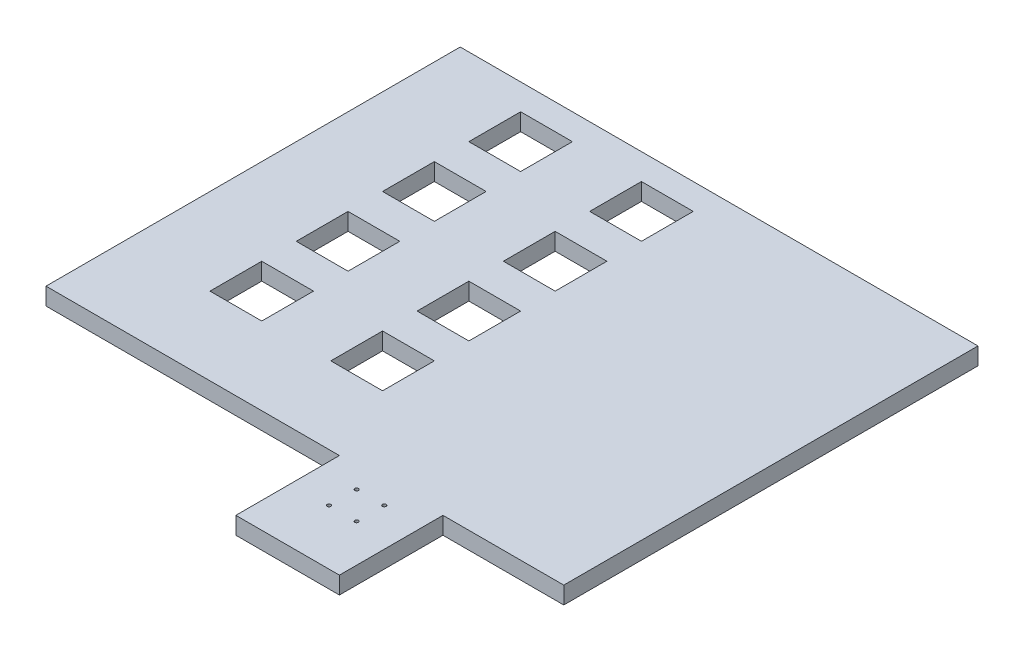
from build123d import *

# Parameters (mm, degrees)
EXTRUDE_1_DEPTH     = 10
SKETCH_2_W          = 20
SKETCH_2_H          = 20
SKETCH_2_R          = 1.05
CUT_EXTRUDE_1_DEPTH = 8
SKETCH_2_3_R        = 1.05
CUT_EXTRUDE_2_DEPTH = 235.520787991
SKETCH_3_W          = 30
SKETCH_3_H          = 30
CUT_EXTRUDE_3_DEPTH = 235.520787991


with BuildPart() as part:
    # 草圖1 → 填料-伸長1 (new body)
    with BuildSketch(Plane(origin=(0, 0, 0), x_dir=(1, 0, 0), z_dir=(0, 1, 0))):
        Polygon((-150, -120), (20, -120), (20, -180), (80, -180), (80, -120), (150, -120), (150, 120), (-150, 120), align=None)
    extrude(amount=EXTRUDE_1_DEPTH)

    # 草圖2 → 除料-伸長1 (cut)
    with BuildSketch(Plane.XZ):
        with Locations((50, 140)):
            Rectangle(SKETCH_2_W, SKETCH_2_H)
        with Locations((42, 132)):
            Circle(SKETCH_2_R, mode=Mode.SUBTRACT)
        with Locations((58, 132)):
            Circle(SKETCH_2_R, mode=Mode.SUBTRACT)
        with Locations((42, 148)):
            Circle(SKETCH_2_R, mode=Mode.SUBTRACT)
        with Locations((58, 148)):
            Circle(SKETCH_2_R, mode=Mode.SUBTRACT)
    extrude(amount=-CUT_EXTRUDE_1_DEPTH, mode=Mode.SUBTRACT)

    # 草圖2<3> → 除料-伸長2 (cut, through all)
    with BuildSketch(Plane.XZ):
        with Locations((42, 132)):
            Circle(SKETCH_2_3_R)
        with Locations((42, 148)):
            Circle(SKETCH_2_3_R)
        with Locations((58, 132)):
            Circle(SKETCH_2_3_R)
        with Locations((58, 148)):
            Circle(SKETCH_2_3_R)
    extrude(amount=-CUT_EXTRUDE_2_DEPTH, mode=Mode.SUBTRACT)

    # 草圖3 → 除料-伸長3 (cut, through all)
    with BuildSketch(Plane(origin=(0, 10, 0), x_dir=(1, 0, 0), z_dir=(0, 1, 0))):
        with Locations((-85, -60)):
            Rectangle(SKETCH_3_W, SKETCH_3_H)
        with Locations((-85, -10)):
            Rectangle(SKETCH_3_W, SKETCH_3_H)
        with Locations((-85, 40)):
            Rectangle(SKETCH_3_W, SKETCH_3_H)
        with Locations((-85, 90)):
            Rectangle(SKETCH_3_W, SKETCH_3_H)
        with Locations((-15, -60)):
            Rectangle(SKETCH_3_W, SKETCH_3_H)
        with Locations((-15, -10)):
            Rectangle(SKETCH_3_W, SKETCH_3_H)
        with Locations((-15, 40)):
            Rectangle(SKETCH_3_W, SKETCH_3_H)
        with Locations((-15, 90)):
            Rectangle(SKETCH_3_W, SKETCH_3_H)
    extrude(amount=-CUT_EXTRUDE_3_DEPTH, mode=Mode.SUBTRACT)


solid = part.part
